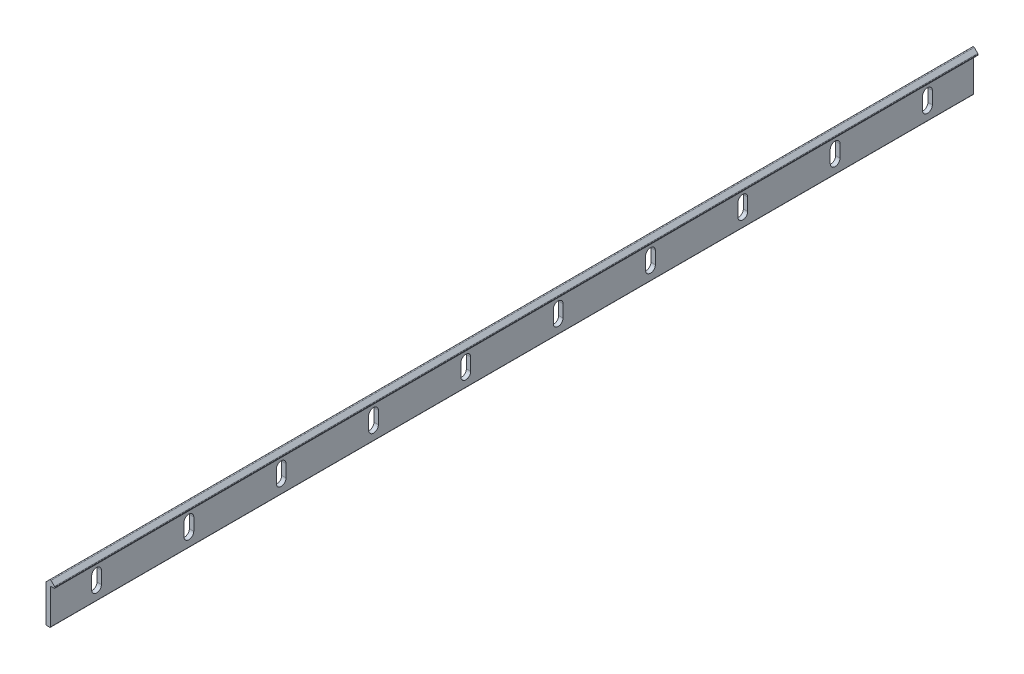
from build123d import *

# Parameters (mm, degrees)
BOSS_EXTRUDE1_DEPTH = 500
FILLET1_R           = 0.50329666
FILLET2_R           = 0.50398302
FILLET3_R           = 0.30157619
FILLET4_R           = 0.30157551
CUT_EXTRUDE1_REACH  = 502.528
LPATTERN1_COUNT     = 10
LPATTERN1_PITCH     = 50


with BuildPart() as part:
    # Sketch1 → Boss-Extrude1 (new body)
    with BuildSketch(Plane.XY):
        with BuildLine():
            Line((0, 20.330194912), (2.019589054, 22.349783966))
            ThreePointArc((2.019589054, 22.349783966), (2.375, 22.497), (2.730410946, 22.349783966))
            Line((2.730410946, 22.349783966), (4.75, 20.330194912))
            Line((4.75, 20.330194912), (4.75, 19.5291))
            Line((4.75, 19.5291), (2.375, 19.5291))
            Line((2.375, 19.5291), (2.375, 0))
            Line((2.375, 0), (0, 0))
            Line((0, 0), (0, 20.330194912))
        make_face()
    extrude(amount=BOSS_EXTRUDE1_DEPTH)

    # Fillet1
    fillet1_edges = [part.edges().sort_by_distance(p)[0] for p in [
        (0, 20.330194912, 250),
    ]]
    fillet(fillet1_edges, radius=FILLET1_R)

    # Fillet2
    fillet2_edges = [part.edges().sort_by_distance(p)[0] for p in [
        (4.75, 20.330194912, 250),
    ]]
    fillet(fillet2_edges, radius=FILLET2_R)

    # Fillet3
    fillet3_edges = [part.edges().sort_by_distance(p)[0] for p in [
        (4.75, 19.5291, 250),
    ]]
    fillet(fillet3_edges, radius=FILLET3_R)

    # Fillet4
    fillet4_edges = [part.edges().sort_by_distance(p)[0] for p in [
        (2.375, 0, 250),
        (0, 0, 250),
    ]]
    fillet(fillet4_edges, radius=FILLET4_R)

    # Sketch2 → Cut-Extrude1 (cut, up to next)
    with BuildSketch(Plane.ZY, mode=Mode.PRIVATE) as cut_extrude1_sk1:
        with BuildLine():
            Line((27.65, 13.1043), (27.65, 6.4043))
            ThreePointArc((27.65, 6.4043), (25, 3.7543), (22.35, 6.4043))
            Line((22.35, 6.4043), (22.35, 13.1043))
            ThreePointArc((22.35, 13.1043), (25, 15.7543), (27.65, 13.1043))
        make_face()
    cut_extrude1_tool1 = extrude(cut_extrude1_sk1.sketch, amount=-CUT_EXTRUDE1_REACH, mode=Mode.PRIVATE) & part.part
    cut_extrude1 = cut_extrude1_tool1.solids().sort_by_distance((0, 9.7543, 25))[0]
    add(cut_extrude1, mode=Mode.SUBTRACT)

    # LPattern1: Cut-Extrude1 ×10
    with Locations(*[(0, 0, i * LPATTERN1_PITCH) for i in range(1, LPATTERN1_COUNT)]):
        add(cut_extrude1, mode=Mode.SUBTRACT)


solid = part.part
